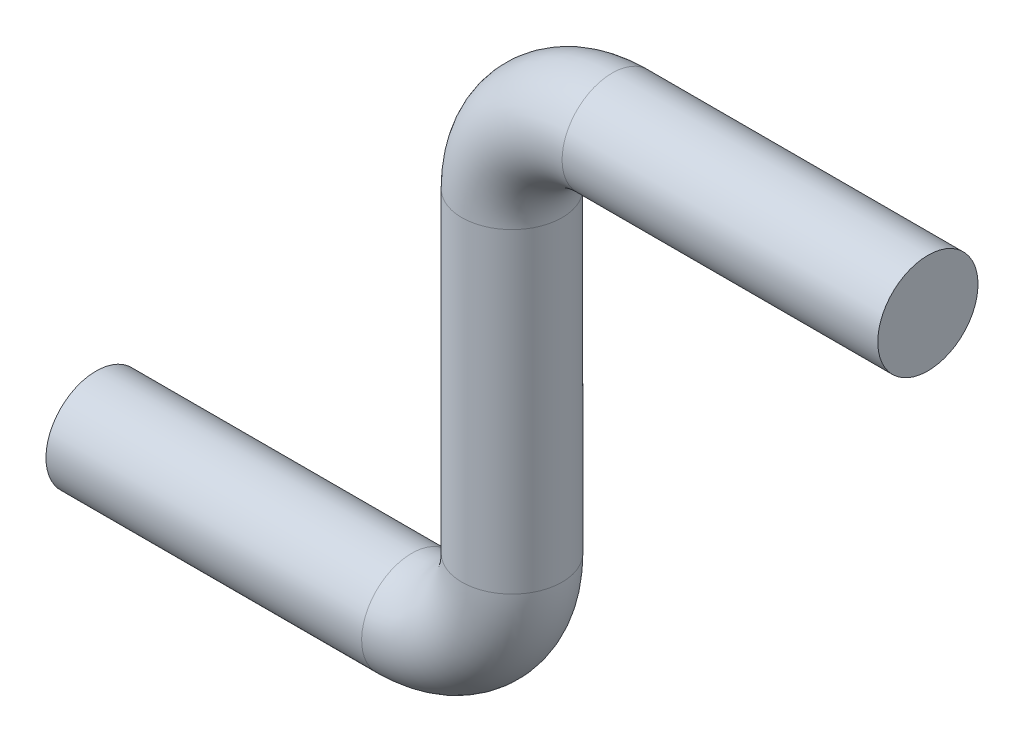
from build123d import *

# Parameters (mm, degrees)
SKETCH2_R = 0.79375


with BuildPart() as part:
    # Sweep1: sweep along a path in Sketch1
    with BuildLine(Plane.XY) as sweep1_path:
        Line((0, 0), (5, 0))
        ThreePointArc((5, 0), (6.122532015, 0.464967985), (6.5875, 1.5875))
        Line((6.5875, 1.5875), (6.5875, 6.5875))
        ThreePointArc((6.5875, 6.5875), (7.052467985, 7.710032015), (8.175, 8.175))
        Line((8.175, 8.175), (13.175, 8.175))
    # Sketch2 → Sweep1 (sweep)
    with BuildSketch(Plane(origin=(0, 0, 0), x_dir=(0, 0, -1), z_dir=(1, 0, 0))):
        Circle(SKETCH2_R)
    sweep(path=sweep1_path.line)


solid = part.part
